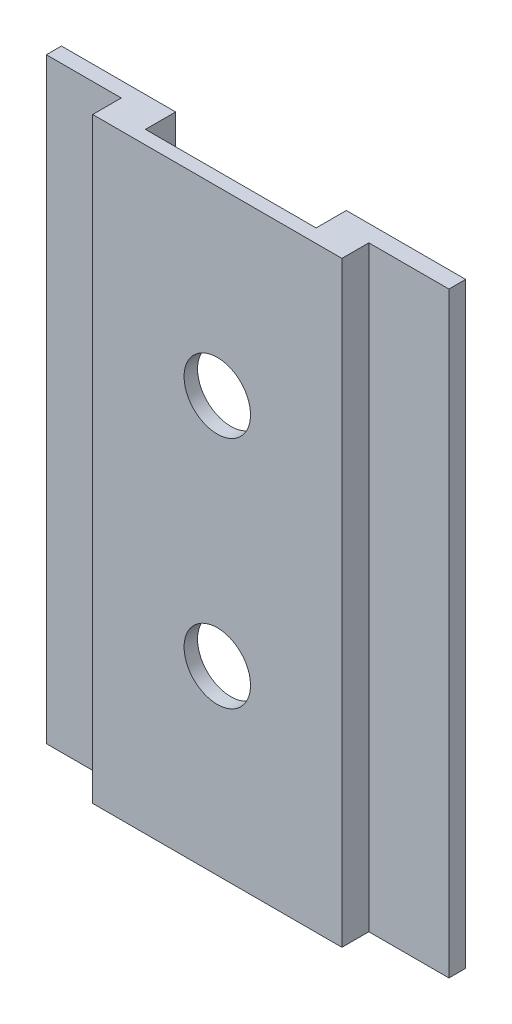
from build123d import *

# Parameters (mm, degrees)
BOSS_EXTRUDE1_DEPTH = 50.165
SKETCH2_R           = 2.794
CUT_EXTRUDE1_DEPTH  = 50.165


with BuildPart() as part:
    # Sketch1 → Boss-Extrude1 (new body)
    with BuildSketch(Plane(origin=(0, 0, 0), x_dir=(1, 0, 0), z_dir=(0, 1, 0))):
        Polygon((0, 0), (20.955, 0), (20.955, 2.265814212), (27.686, 2.265814212), (27.686, 3.673545632), (17.653, 3.673545632), (17.653, 1.132907106), (3.302, 1.132907106), (3.302, 3.673545632), (-6.2992, 3.673545632), (-6.2992, 2.403226369), (0, 2.403226369), align=None)
    extrude(amount=BOSS_EXTRUDE1_DEPTH)

    # Sketch2 → Cut-Extrude1 (cut)
    with BuildSketch(Plane(origin=(0, 0, -1.132907106), x_dir=(-1, 0, 0), z_dir=(0, 0, -1))):
        with Locations((-10.4775, 34.925)):
            Circle(SKETCH2_R)
        with Locations((-10.4775, 15.24)):
            Circle(SKETCH2_R)
    extrude(amount=-CUT_EXTRUDE1_DEPTH, mode=Mode.SUBTRACT)


solid = part.part
